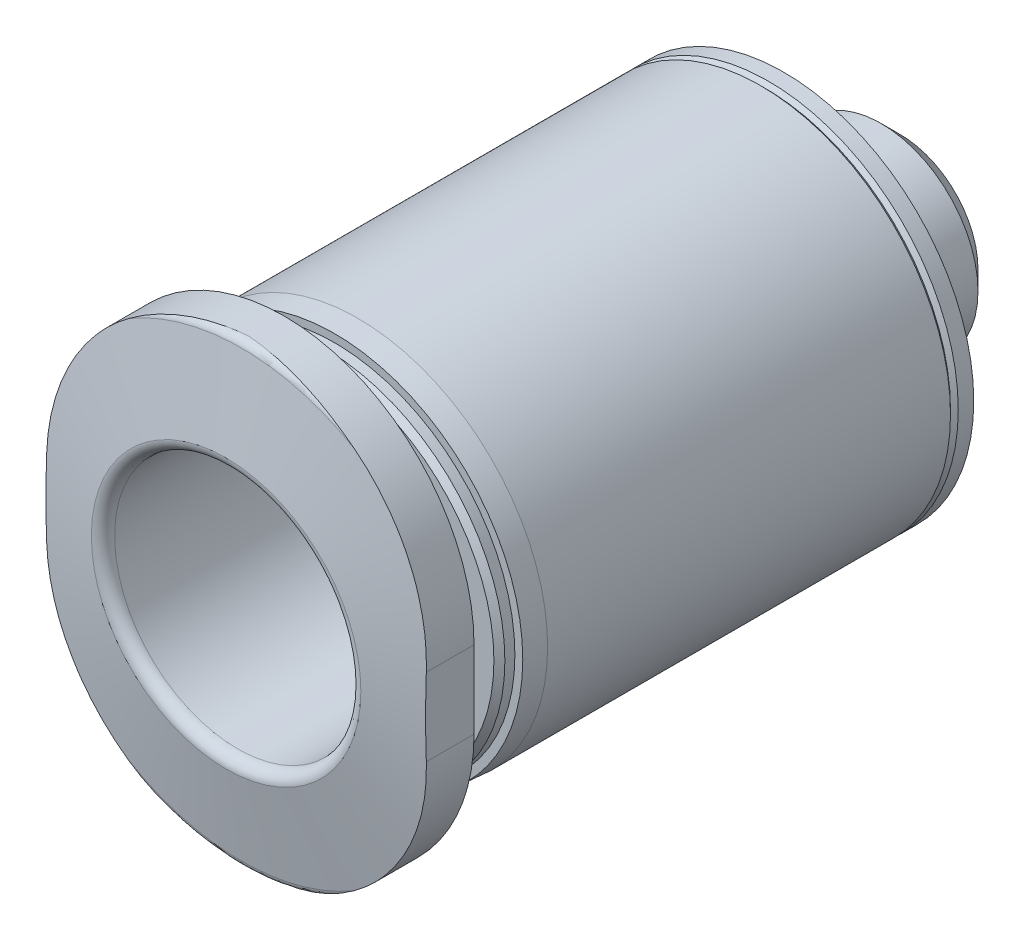
from build123d import *

# Parameters (mm, degrees)
SKETCH2_W          = 23.6
SKETCH2_H          = 23.6
CUT_EXTRUDE1_DEPTH = 1.5
CUT_EXTRUDE2_DEPTH = 5.7


with BuildPart() as part:
    # Sketch1 → Revolve1 (revolve)
    with BuildSketch(Plane(origin=(0, 0, 0), x_dir=(0, 0, -1), z_dir=(1, 0, 0)), mode=Mode.PRIVATE) as revolve1_sk:
        with BuildLine():
            Line((-14.4, 0), (-14.4, 3.4785))
            Line((-14.4, 3.4785), (-14.002165841, 5.734729636))
            ThreePointArc((-14.002165841, 5.734729636), (-13.933761812, 5.853208889), (-13.80520429, 5.9))
            Line((-13.80520429, 5.9), (-12.9, 5.9))
            Line((-12.9, 5.9), (-12.9, 4.2535))
            ThreePointArc((-12.9, 4.2535), (-12.790165043, 3.988334957), (-12.525, 3.8785))
            Line((-12.525, 3.8785), (-12, 3.8785))
            Line((-12, 3.8785), (-12, 4.513578644))
            Line((-12, 4.513578644), (-11.858578644, 4.655))
            Line((-11.858578644, 4.655), (-11.6, 4.655))
            Line((-11.6, 4.655), (-11.6, 4.858043913))
            Line((-11.6, 4.858043913), (-11, 4.9))
            Line((-11, 4.9), (-0.6, 4.9))
            Line((-0.6, 4.9), (-0.5, 4.8))
            Line((-0.5, 4.8), (-0.4, 4.9))
            Line((-0.4, 4.9), (0, 4.9))
            Line((0, 4.9), (0, 2.5))
            Line((0, 2.5), (2.5095, 2.5))
            Line((2.5095, 2.5), (3, 2.0095))
            Line((3, 2.0095), (3, 0))
            Line((3, 0), (-14.4, 0))
        make_face()
    revolve(revolve1_sk.sketch.rotate(Axis((0, 0, -3), (0, 0, 1)), 270), axis=Axis((0, 0, -3), (0, 0, 1)))

    # Sketch2 → Cut-Extrude1 (cut)
    with BuildSketch(Plane.XY.offset(14.4)):
        Rectangle(SKETCH2_W, SKETCH2_H)
        with BuildLine():
            Line((-4.9, 1), (-4.9, -1))
            ThreePointArc((-4.9, -1), (0, -5.9), (4.9, -1))
            Line((4.9, -1), (4.9, 1))
            ThreePointArc((4.9, 1), (0, 5.9), (-4.9, 1))
        make_face(mode=Mode.SUBTRACT)
    extrude(amount=-CUT_EXTRUDE1_DEPTH, mode=Mode.SUBTRACT)

    # Sketch3 → Cut-Extrude2 (cut)
    with BuildSketch(Plane.XY.offset(-3)):
        Polygon((-1.25, -0.721687836), (0, -1.443375673), (1.25, -0.721687836), (1.25, 0.721687836), (0, 1.443375673), (-1.25, 0.721687836), align=None)
    extrude(amount=CUT_EXTRUDE2_DEPTH, mode=Mode.SUBTRACT)

    # Sketch4 → Cut-Revolve1 (revolve, cut)
    with BuildSketch(Plane(origin=(0, 0, 0), x_dir=(0, 0, -1), z_dir=(1, 0, 0)), mode=Mode.PRIVATE) as cut_revolve1_sk:
        with BuildLine():
            Line((-14.4, 0), (-14.4, 3.4785))
            ThreePointArc((-14.4, 3.4785), (-14.312132034, 3.266367966), (-14.1, 3.1785))
            Line((-14.1, 3.1785), (-2.7, 3.1785))
            Line((-2.7, 3.1785), (-2.7, 0))
            Line((-2.7, 0), (-14.4, 0))
        make_face()
    revolve(cut_revolve1_sk.sketch.rotate(Axis((0, 0, 2.7), (0, 0, 1)), 270), axis=Axis((0, 0, 2.7), (0, 0, 1)), mode=Mode.SUBTRACT)


solid = part.part
